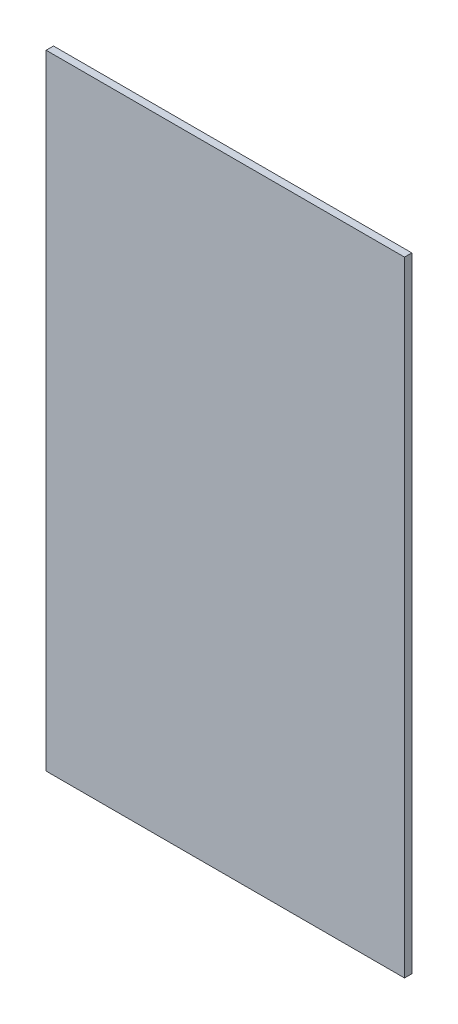
from build123d import *

# Parameters (mm, degrees)
SKETCH_1_W      = 97.57445865
SKETCH_1_H      = 170
EXTRUDE_1_DEPTH = 2


with BuildPart() as part:
    # 草图1 → 凸台-拉伸1 (new body)
    with BuildSketch(Plane.XY):
        with Locations((58.787229325, 85)):
            Rectangle(SKETCH_1_W, SKETCH_1_H)
    extrude(amount=-EXTRUDE_1_DEPTH)


solid = part.part
